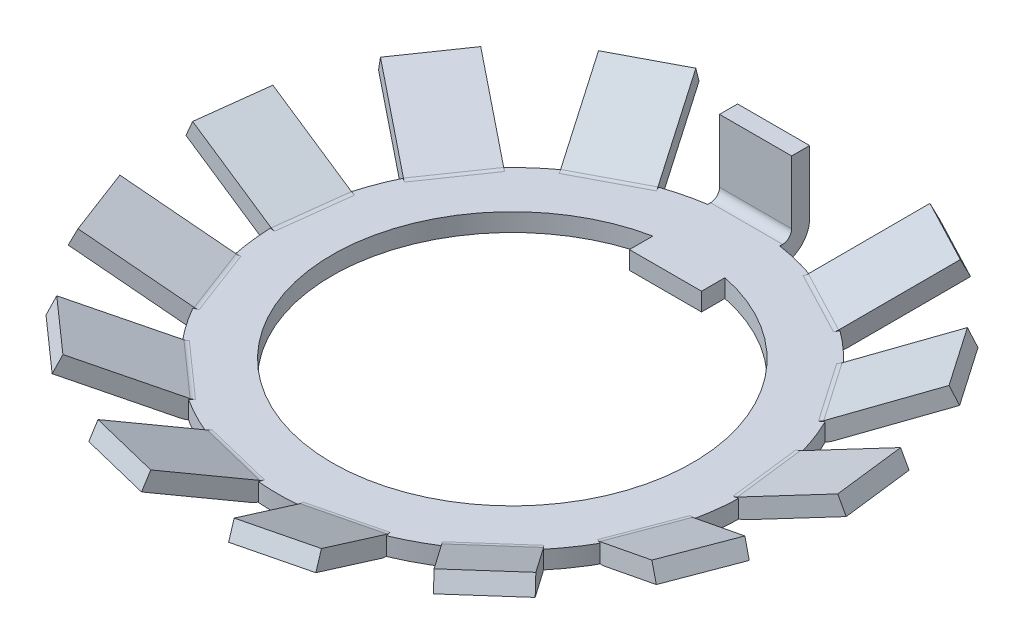
from build123d import *

# Parameters (mm, degrees)
ESQUISSE1_W             = 3
ESQUISSE1_H             = 1
LANGUETTE_PLI_E_DEPTH   = 2
LANGUETTE_DEPTH         = 2
NBR_DE_LANGUETTES_COUNT = 12
NBR_DE_LANGUETTES_ANGLE = 304.615384615


with BuildPart() as part:
    # Esquisse1 → Base (revolve)
    with BuildSketch(Plane.XY, mode=Mode.PRIVATE) as base_sk:
        with Locations((11.5, 0.5)):
            Rectangle(ESQUISSE1_W, ESQUISSE1_H)
    revolve(base_sk.sketch.rotate(Axis((0, 0, 0), (0, 1, 0)), 90), axis=Axis((0, 0, 0), (0, 1, 0)))

    # Esquisse3 → Languette pliée (add, symmetric)
    with BuildSketch(Plane(origin=(0, 0, 0), x_dir=(0, 0, -1), z_dir=(1, 0, 0))):
        with BuildLine():
            Line((13.5, 5), (13.5, 1.5))
            ThreePointArc((13.5, 1.5), (13.353553391, 1.146446609), (13, 1))
            Line((13, 1), (10, 1))
            Line((10, 1), (8.5, 1))
            Line((8.5, 1), (8.5, 0))
            Line((8.5, 0), (10, 0))
            Line((10, 0), (13, 0))
            ThreePointArc((13, 0), (14.060660172, 0.439339828), (14.5, 1.5))
            Line((14.5, 1.5), (14.5, 5))
            Line((14.5, 5), (13.5, 5))
        make_face()
    extrude(amount=LANGUETTE_PLI_E_DEPTH, both=True)

    # Esquisse2 → Languette (add, symmetric)
    with BuildSketch(Plane(origin=(0, 0, 0), x_dir=(-0.46472317204377556, 0, 0.8854560256532064), z_dir=(-0.8854560256532064, 0, -0.46472317204377556))):
        with BuildLine():
            Line((-10, 1), (-12.577381738, 1))
            ThreePointArc((-12.577381738, 1), (-12.685601545, 1.011851996), (-12.788690869, 1.046846106))
            Line((-12.788690869, 1.046846106), (-17.788690869, 3.378384397))
            Line((-17.788690869, 3.378384397), (-18.211309131, 2.47207661))
            Line((-18.211309131, 2.47207661), (-13.211309131, 0.140538319))
            ThreePointArc((-13.211309131, 0.140538319), (-12.902041159, 0.035555989), (-12.577381738, 0))
            Line((-12.577381738, 0), (-10, 0))
            Line((-10, 0), (-10, 1))
        make_face()
    languette = extrude(amount=LANGUETTE_DEPTH, both=True)

    # Nbr de languettes: Languette ×12 about axis
    nbr_de_languettes_axis = Axis((0, 0, 0), (0, -1, 0))
    for i in range(1, NBR_DE_LANGUETTES_COUNT):
        add(languette.rotate(nbr_de_languettes_axis, i * NBR_DE_LANGUETTES_ANGLE / (NBR_DE_LANGUETTES_COUNT - 1)))


solid = part.part
